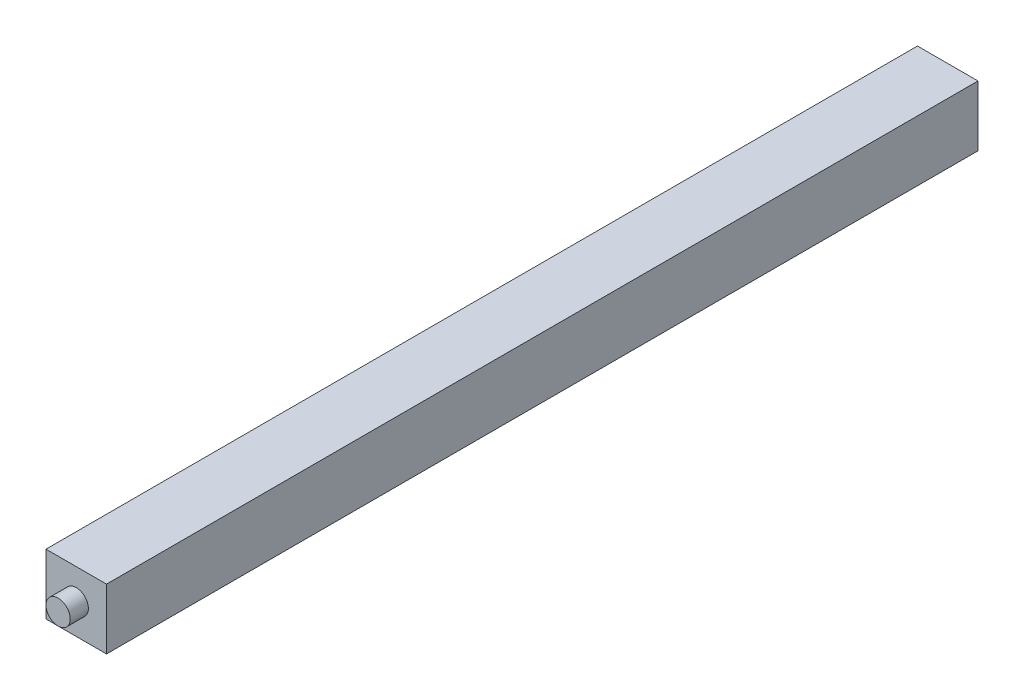
from build123d import *

# Parameters (mm, degrees)
SKETCH1_W           = 50
SKETCH1_H           = 50
BOSS_EXTRUDE1_DEPTH = 720
SKETCH2_R           = 10
BOSS_EXTRUDE2_DEPTH = 15


with BuildPart() as part:
    # Sketch1 → Boss-Extrude1 (new body)
    with BuildSketch(Plane.XY):
        Rectangle(SKETCH1_W, SKETCH1_H)
    extrude(amount=BOSS_EXTRUDE1_DEPTH)

    # Sketch2 → Boss-Extrude2 (add)
    with BuildSketch(Plane.XY.offset(720)):
        Circle(SKETCH2_R)
    extrude(amount=BOSS_EXTRUDE2_DEPTH)


solid = part.part
